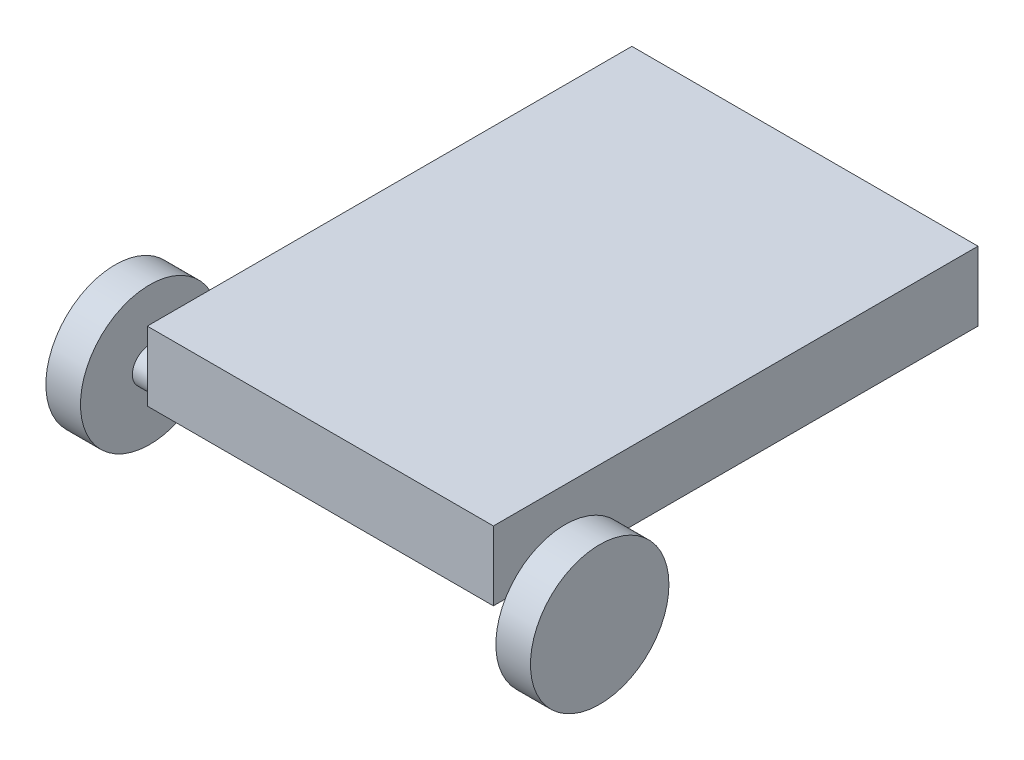
from build123d import *

# Parameters (mm, degrees)
CROQUIS2_W                   = 50
CROQUIS2_H                   = 70
SALIENTE_EXTRUIR1_DEPTH      = 10
SALIENTE_EXTRUIR2_DEPTH      = 30
SALIENTE_EXTRUIR2_DEPTH_BACK = 30
CROQUIS4_R                   = 2.5
CROQUIS5_R                   = 10
SALIENTE_EXTRUIR3_DEPTH      = 5
CROQUIS6_R                   = 2.5
SALIENTE_EXTRUIR4_DEPTH      = 10
REDONDEO1_R                  = 2


with BuildPart() as part:
    # Croquis2 → Saliente-Extruir1 (new body)
    with BuildSketch(Plane(origin=(0, 0, 0), x_dir=(1, 0, 0), z_dir=(0, 1, 0))):
        Rectangle(CROQUIS2_W, CROQUIS2_H)
    extrude(amount=SALIENTE_EXTRUIR1_DEPTH)

    # Croquis4 → Saliente-Extruir2 (add, two sides: drawn at the far end of the back side and taken through both)
    with BuildSketch(Plane(origin=(0, 0, 0), x_dir=(0, 0, -1), z_dir=(1, 0, 0)).offset(-SALIENTE_EXTRUIR2_DEPTH_BACK)):
        with Locations((-29.646809276, 0)):
            Circle(CROQUIS4_R)
    extrude(amount=SALIENTE_EXTRUIR2_DEPTH + SALIENTE_EXTRUIR2_DEPTH_BACK)

    # Croquis5 → Saliente-Extruir3 (add)
    with BuildSketch(Plane(origin=(30, 0, 0), x_dir=(0, 0, -1), z_dir=(1, 0, 0))):
        with Locations((-29.646809276, 0)):
            Circle(CROQUIS5_R)
    saliente_extruir3 = extrude(amount=SALIENTE_EXTRUIR3_DEPTH)

    # Simetría1: Saliente-Extruir3 across plane
    add(saliente_extruir3.mirror(Plane(origin=(0, 0, 0), x_dir=(0, 0, 1), z_dir=(1, 0, 0))))

    # Croquis6 → Saliente-Extruir4 (add)
    with BuildSketch(Plane.XZ):
        with Locations(Location((0, -30, 0), (0, 0, 270))):
            Circle(CROQUIS6_R)
    extrude(amount=SALIENTE_EXTRUIR4_DEPTH)

    # Redondeo1
    redondeo1_edges = [part.edges().sort_by_distance(p)[0] for p in [
        (0, -10, -27.5),
    ]]
    fillet(redondeo1_edges, radius=REDONDEO1_R)


solid = part.part
